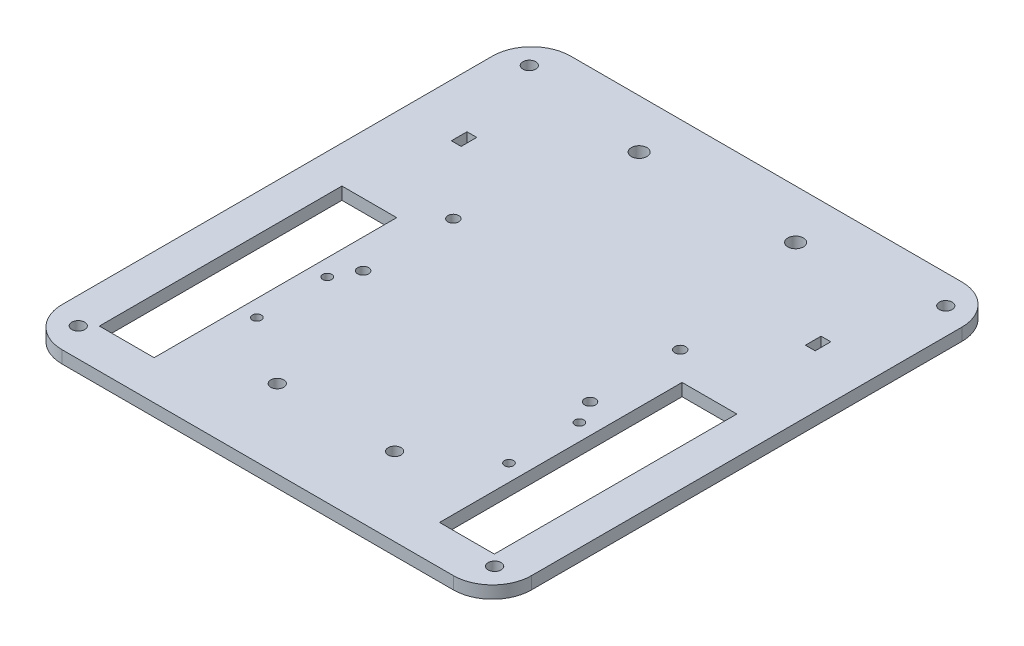
from build123d import *

# Parameters (mm, degrees)
SKETCH1_W           = 120
SKETCH1_H           = 130
SKETCH1_R           = 1.4
SKETCH1_R_2         = 1.15
SKETCH1_R_3         = 2
SKETCH1_R_4         = 1.65
SKETCH1_W_2         = 14
SKETCH1_H_2         = 62
SKETCH1_W_3         = 2.5
SKETCH1_H_3         = 4
BOSS_EXTRUDE1_DEPTH = 3.175
FILLET1_R           = 10


with BuildPart() as part:
    # Sketch1 → Boss-Extrude1 (new body)
    with BuildSketch(Plane(origin=(0, 0, 0), x_dir=(1, 0, 0), z_dir=(0, 1, 0))):
        Rectangle(SKETCH1_W, SKETCH1_H)
        with Locations(Location((29, 14, 0), (0, 0, 270))):
            Circle(SKETCH1_R, mode=Mode.SUBTRACT)
        with Locations(Location((29, -9.05, 0), (0, 0, 270))):
            Circle(SKETCH1_R, mode=Mode.SUBTRACT)
        with Locations(Location((-29, -9.05, 0), (0, 0, 270))):
            Circle(SKETCH1_R, mode=Mode.SUBTRACT)
        with Locations(Location((-29, 14, 0), (0, 0, 270))):
            Circle(SKETCH1_R, mode=Mode.SUBTRACT)
        with Locations(Location((32.225, -15, 0), (0, 0, 270))):
            Circle(SKETCH1_R_2, mode=Mode.SUBTRACT)
        with Locations(Location((32.225, -33, 0), (0, 0, 270))):
            Circle(SKETCH1_R_2, mode=Mode.SUBTRACT)
        with Locations(Location((-32.225, -33, 0), (0, 0, 270))):
            Circle(SKETCH1_R_2, mode=Mode.SUBTRACT)
        with Locations(Location((-32.225, -15, 0), (0, 0, 270))):
            Circle(SKETCH1_R_2, mode=Mode.SUBTRACT)
        with Locations(Location((20, 52.5, 0), (0, 0, 270))):
            Circle(SKETCH1_R_3, mode=Mode.SUBTRACT)
        with Locations(Location((-20, 52.5, 0), (0, 0, 270))):
            Circle(SKETCH1_R_3, mode=Mode.SUBTRACT)
        with Locations(Location((53.217198973, -57.651965554, 0), (0, 0, 270))):
            Circle(SKETCH1_R_4, mode=Mode.SUBTRACT)
        with Locations(Location((53.217198973, 57.651965554, 0), (0, 0, 270))):
            Circle(SKETCH1_R_4, mode=Mode.SUBTRACT)
        with Locations(Location((-53.217198973, -57.651965554, 0), (0, 0, 270))):
            Circle(SKETCH1_R_4, mode=Mode.SUBTRACT)
        with Locations(Location((-53.217198973, 57.651965554, 0), (0, 0, 270))):
            Circle(SKETCH1_R_4, mode=Mode.SUBTRACT)
        with Locations(Location((-15, -45, 0), (0, 0, 270))):
            Circle(SKETCH1_R_4, mode=Mode.SUBTRACT)
        with Locations(Location((15, -45, 0), (0, 0, 270))):
            Circle(SKETCH1_R_4, mode=Mode.SUBTRACT)
        with Locations((-43.475, -24)):
            Rectangle(SKETCH1_W_2, SKETCH1_H_2, mode=Mode.SUBTRACT)
        with Locations((43.475, -24)):
            Rectangle(SKETCH1_W_2, SKETCH1_H_2, mode=Mode.SUBTRACT)
        with Locations((45.25, 33)):
            Rectangle(SKETCH1_W_3, SKETCH1_H_3, mode=Mode.SUBTRACT)
        with Locations((-45.25, 33)):
            Rectangle(SKETCH1_W_3, SKETCH1_H_3, mode=Mode.SUBTRACT)
    extrude(amount=BOSS_EXTRUDE1_DEPTH)

    # Fillet1
    fillet1_edges = [part.edges().sort_by_distance(p)[0] for p in [
        (60, 1.5875, 65),
        (-60, 1.5875, 65),
        (-60, 1.5875, -65),
        (60, 1.5875, -65),
    ]]
    fillet(fillet1_edges, radius=FILLET1_R)


solid = part.part
